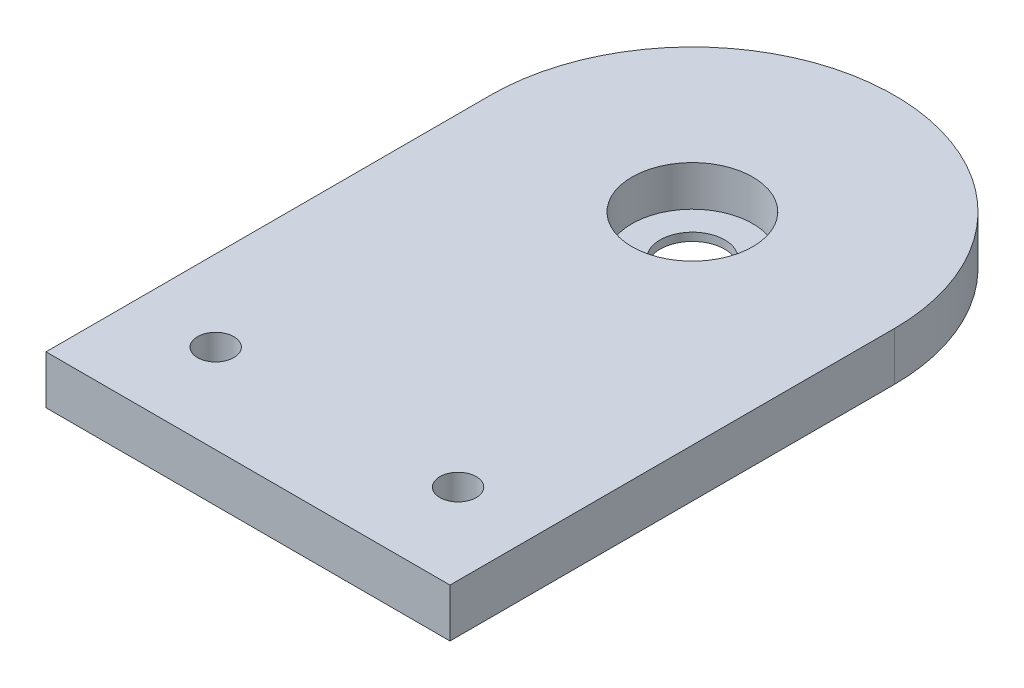
from build123d import *

# Parameters (mm, degrees)
PLACA_START              = -40.5
SK_PLACA_W               = 50
SK_PLACA_H               = 36
PLACA_DEPTH              = 6
EXTREMO_START            = -40.5
SK_EXTREMO_R             = 25
EXTREMO_DEPTH            = 6
ALOJAMIENTO_696ZZ_START  = -39.5
SK_ALOJAMIENTO_696ZZ_R   = 7.475
ALOJAMIENTO_696ZZ_DEPTH  = 5
PASO_EXTRACTOR_START     = -40.5
SK_PASO_EXTRACTOR_R      = 4
PASO_EXTRACTOR_DEPTH     = 1
EXTENSION_PESTANAS_START = -40.5
SK_EXTENSION_PESTANAS_W  = 50
SK_EXTENSION_PESTANAS_H  = 19
EXTENSION_PESTANAS_DEPTH = 6
PASANTES_M4_REPISA_START = -40.5
SK_PASANTES_M4_REPISA_R  = 2.25
PASANTES_M4_REPISA_DEPTH = 6


with BuildPart() as part:
    # Sk_Placa → Placa (new body)
    with BuildSketch(Plane(origin=(0, 0, 0), x_dir=(1, 0, 0), z_dir=(0, 1, 0)).offset(PLACA_START)):
        with Locations((0, -508)):
            Rectangle(SK_PLACA_W, SK_PLACA_H)
    extrude(amount=PLACA_DEPTH)

    # Sk_Extremo → Extremo (add)
    with BuildSketch(Plane(origin=(0, 0, 0), x_dir=(1, 0, 0), z_dir=(0, 1, 0)).offset(EXTREMO_START)):
        with Locations((0, -490)):
            Circle(SK_EXTREMO_R)
    extrude(amount=EXTREMO_DEPTH)

    # Sk_Alojamiento_696ZZ → Alojamiento_696ZZ (cut)
    with BuildSketch(Plane(origin=(0, 0, 0), x_dir=(1, 0, 0), z_dir=(0, 1, 0)).offset(ALOJAMIENTO_696ZZ_START)):
        with Locations(Location((0, -490, 0), (0, 0, 270))):
            Circle(SK_ALOJAMIENTO_696ZZ_R)
    extrude(amount=ALOJAMIENTO_696ZZ_DEPTH, mode=Mode.SUBTRACT)

    # Sk_Paso_extractor → Paso_extractor (cut)
    with BuildSketch(Plane(origin=(0, 0, 0), x_dir=(1, 0, 0), z_dir=(0, 1, 0)).offset(PASO_EXTRACTOR_START)):
        with Locations(Location((0, -490, 0), (0, 0, 270))):
            Circle(SK_PASO_EXTRACTOR_R)
    extrude(amount=PASO_EXTRACTOR_DEPTH, mode=Mode.SUBTRACT)

    # Sk_Extension_pestanas → Extension_pestanas (add)
    with BuildSketch(Plane(origin=(0, 0, 0), x_dir=(1, 0, 0), z_dir=(0, 1, 0)).offset(EXTENSION_PESTANAS_START)):
        with Locations((0, -535.5)):
            Rectangle(SK_EXTENSION_PESTANAS_W, SK_EXTENSION_PESTANAS_H)
    extrude(amount=EXTENSION_PESTANAS_DEPTH)

    # Sk_Pasantes_M4_repisa → Pasantes_M4_repisa (cut)
    with BuildSketch(Plane(origin=(0, 0, 0), x_dir=(1, 0, 0), z_dir=(0, 1, 0)).offset(PASANTES_M4_REPISA_START)):
        with Locations(Location((-15, -534, 0), (0, 0, 270))):
            Circle(SK_PASANTES_M4_REPISA_R)
        with Locations(Location((15, -534, 0), (0, 0, 270))):
            Circle(SK_PASANTES_M4_REPISA_R)
    extrude(amount=PASANTES_M4_REPISA_DEPTH, mode=Mode.SUBTRACT)


solid = part.part
